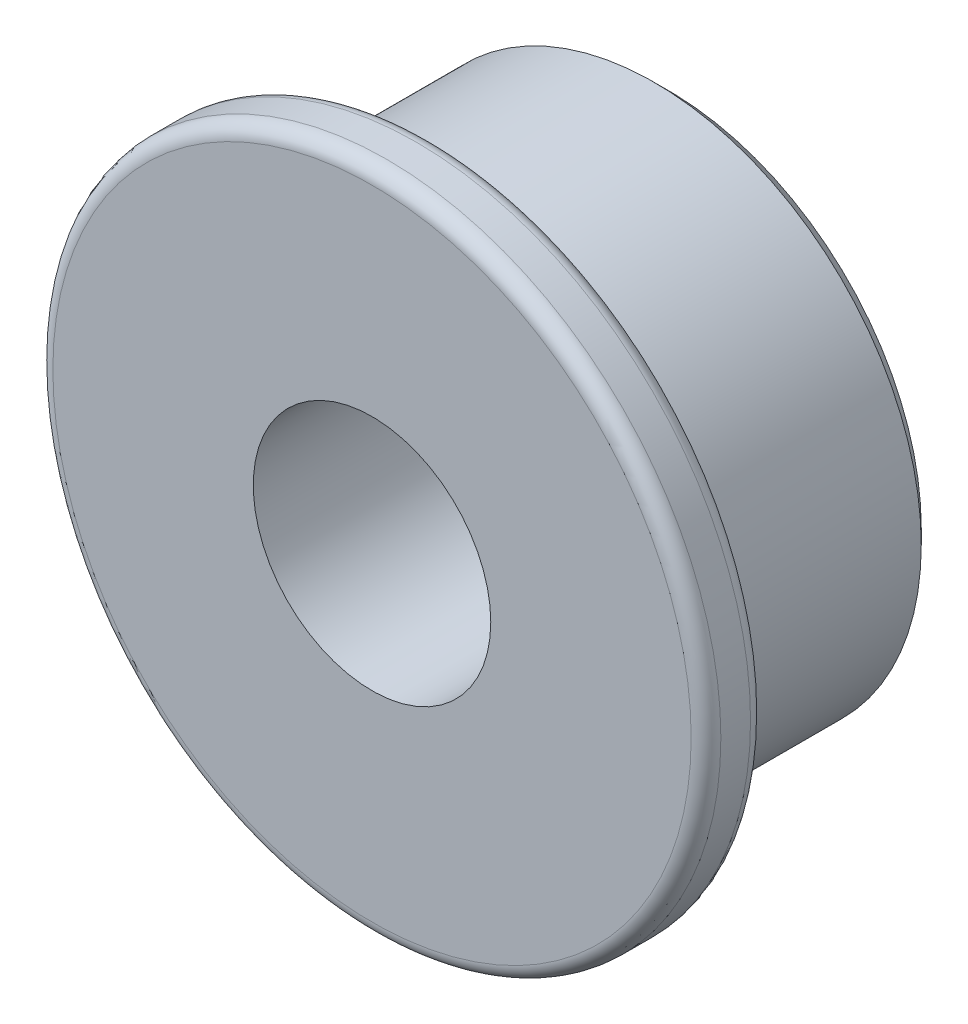
from build123d import *

# Parameters (mm, degrees)
SKETCH1_R           = 9
SKETCH1_R_2         = 4
BOSS_EXTRUDE1_DEPTH = 8
BOSS_EXTRUDE2_START = 2
SKETCH2_R           = 11.25
SKETCH2_R_2         = 4
BOSS_EXTRUDE2_DEPTH = 2
FILLET1_R           = 0.5
FILLET2_R           = 0.5
FILLET3_R           = 0.8
CHAMFER1_SIZE       = 0.5


with BuildPart() as part:
    # Sketch1 → Boss-Extrude1 (new body)
    with BuildSketch(Plane.XY):
        Circle(SKETCH1_R)
        Circle(SKETCH1_R_2, mode=Mode.SUBTRACT)
    extrude(amount=-BOSS_EXTRUDE1_DEPTH)

    # Sketch2 → Boss-Extrude2 (add)
    with BuildSketch(Plane.XY.offset(BOSS_EXTRUDE2_START)):
        Circle(SKETCH2_R)
        Circle(SKETCH2_R_2, mode=Mode.SUBTRACT)
    extrude(amount=-BOSS_EXTRUDE2_DEPTH)

    # Fillet1
    fillet1_edges = [part.edges().sort_by_distance(p)[0] for p in [
        (-11.25, 0, 2),
    ]]
    fillet(fillet1_edges, radius=FILLET1_R)

    # Fillet2
    fillet2_edges = [part.edges().sort_by_distance(p)[0] for p in [
        (-11.25, 0, 0),
    ]]
    fillet(fillet2_edges, radius=FILLET2_R)

    # Fillet3
    fillet3_edges = [part.edges().sort_by_distance(p)[0] for p in [
        (-9, 0, 0),
    ]]
    fillet(fillet3_edges, radius=FILLET3_R)

    # Chamfer1
    chamfer1_edges = [part.edges().sort_by_distance(p)[0] for p in [
        (-9, 0, -8),
    ]]
    chamfer(chamfer1_edges, length=CHAMFER1_SIZE)


solid = part.part
